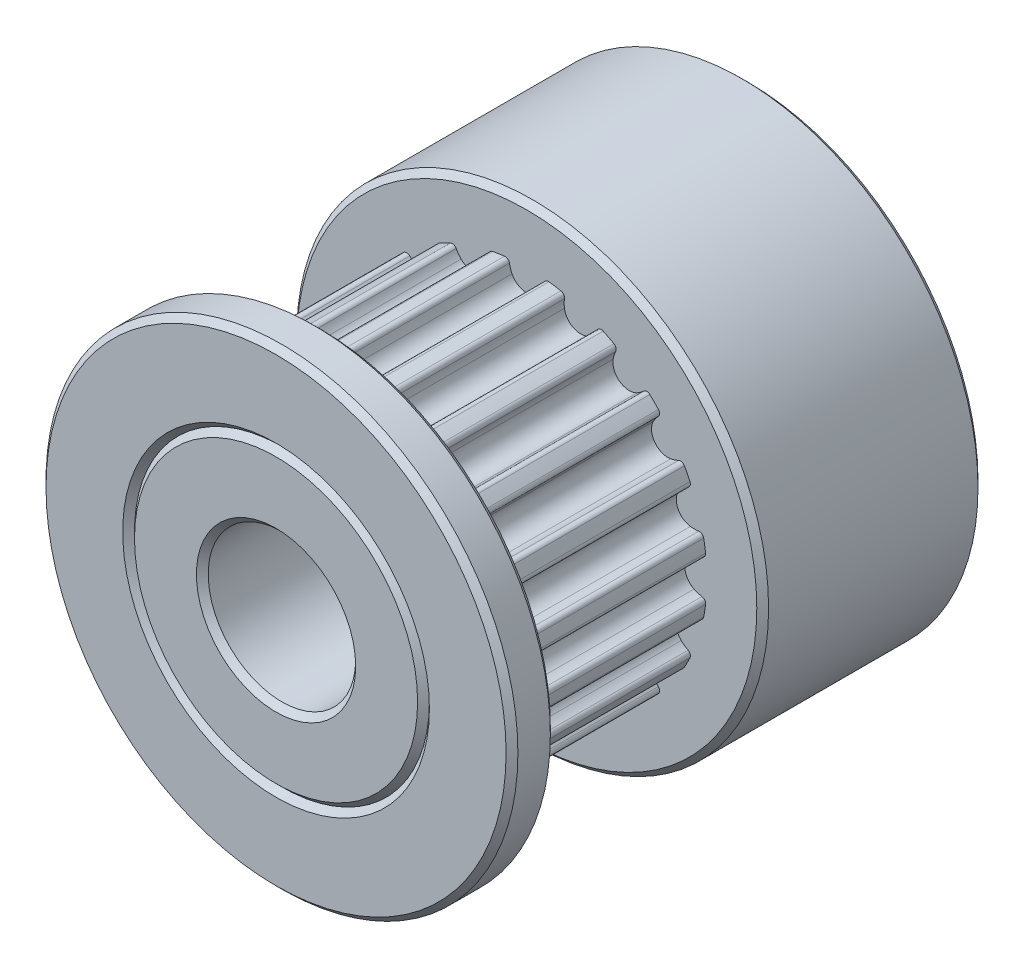
from build123d import *

# Parameters (mm, degrees)
CHAMFER_1_SIZE      = 0.2
CUT_EXTRUDE_START   = -1.5
CUT_EXTRUDE_4_DEPTH = 7
FILLET_1_R          = 0.15


with BuildPart() as part:
    # Эскиз2 → Повернуть1 (revolve)
    with BuildSketch(Plane(origin=(0, 0, 0), x_dir=(0, 0, -1), z_dir=(1, 0, 0)), mode=Mode.PRIVATE) as revolve_1_sk:
        Polygon((0, 4.8), (0, 2.5), (16, 2.5), (16, 4.8), (15.8, 5), (16, 5.2), (16, 8), (8.5, 8), (8.5, 6.11), (1.5, 6.11), (1.5, 8), (0, 8), (0, 5.2), (0.2, 5), align=None)
    revolve(revolve_1_sk.sketch.rotate(Axis((0, 0, 14.55226209), (0, 0, -1)), 90), axis=Axis((0, 0, 14.55226209), (0, 0, -1)))

    # Фаска1
    chamfer_1_edges = [part.edges().sort_by_distance(p)[0] for p in [
        (-8, 0, 0),
        (-8, 0, -1.5),
        (-8, 0, -8.5),
        (-8, 0, -16),
        (-2.5, 0, -16),
        (-2.5, 0, 0),
    ]]
    chamfer(chamfer_1_edges, length=CHAMFER_1_SIZE)

    # Эскиз3 → Вырез-Вытянуть4 (cut)
    with BuildSketch(Plane.XY.offset(CUT_EXTRUDE_START)):
        with BuildLine():
            ThreePointArc((-0.498876404, 5.671797753), (0, 5.36), (0.498876404, 5.671797753))
            ThreePointArc((0.498876404, 5.671797753), (0.570969524, 5.870796774), (0.599565123, 6.080511628))
            ThreePointArc((0.599565123, 6.080511628), (0, 6.11), (-0.599565123, 6.080511628))
            ThreePointArc((-0.599565123, 6.080511628), (-0.570969524, 5.870796774), (-0.498876404, 5.671797753))
        make_face()
        with BuildLine():
            ThreePointArc((2.22714155, 5.240038925), (2.35720026, 5.407020242), (2.449201745, 5.597634394))
            ThreePointArc((2.449201745, 5.597634394), (1.888093836, 5.810955315), (1.30876111, 5.968186019))
            ThreePointArc((1.30876111, 5.968186019), (1.271151687, 5.759898814), (1.278222239, 5.548361499))
            ThreePointArc((1.278222239, 5.548361499), (1.65633109, 5.097662927), (2.22714155, 5.240038925))
        make_face()
        with BuildLine():
            ThreePointArc((3.737398562, 4.295348577), (3.912691811, 4.413966895), (4.059093436, 4.566821705))
            ThreePointArc((4.059093436, 4.566821705), (3.591367892, 4.943093836), (3.088976687, 5.271652779))
            ThreePointArc((3.088976687, 5.271652779), (2.988843715, 5.085181827), (2.930199584, 4.881812964))
            ThreePointArc((2.930199584, 4.881812964), (3.150528952, 4.33633109), (3.737398562, 4.295348577))
        make_face()
        with BuildLine():
            ThreePointArc((4.881812964, 2.930199584), (5.085181827, 2.988843715), (5.271652779, 3.088976687))
            ThreePointArc((5.271652779, 3.088976687), (4.943093836, 3.591367892), (4.566821705, 4.059093436))
            ThreePointArc((4.566821705, 4.059093436), (4.413966895, 3.912691811), (4.295348577, 3.737398562))
            ThreePointArc((4.295348577, 3.737398562), (4.33633109, 3.150528952), (4.881812964, 2.930199584))
        make_face()
        with BuildLine():
            ThreePointArc((5.548361499, 1.278222239), (5.759898814, 1.271151687), (5.968186019, 1.30876111))
            ThreePointArc((5.968186019, 1.30876111), (5.810955315, 1.888093836), (5.597634394, 2.449201745))
            ThreePointArc((5.597634394, 2.449201745), (5.407020242, 2.35720026), (5.240038925, 2.22714155))
            ThreePointArc((5.240038925, 2.22714155), (5.097662927, 1.65633109), (5.548361499, 1.278222239))
        make_face()
        with BuildLine():
            ThreePointArc((5.671797753, -0.498876404), (5.870796774, -0.570969524), (6.080511628, -0.599565123))
            ThreePointArc((6.080511628, -0.599565123), (6.11, 0), (6.080511628, 0.599565123))
            ThreePointArc((6.080511628, 0.599565123), (5.870796774, 0.570969524), (5.671797753, 0.498876404))
            ThreePointArc((5.671797753, 0.498876404), (5.36, 0), (5.671797753, -0.498876404))
        make_face()
        with BuildLine():
            ThreePointArc((5.240038925, -2.22714155), (5.407020242, -2.35720026), (5.597634394, -2.449201745))
            ThreePointArc((5.597634394, -2.449201745), (5.810955315, -1.888093836), (5.968186019, -1.30876111))
            ThreePointArc((5.968186019, -1.30876111), (5.759898814, -1.271151687), (5.548361499, -1.278222239))
            ThreePointArc((5.548361499, -1.278222239), (5.097662927, -1.65633109), (5.240038925, -2.22714155))
        make_face()
        with BuildLine():
            ThreePointArc((4.295348577, -3.737398562), (4.413966895, -3.912691811), (4.566821705, -4.059093436))
            ThreePointArc((4.566821705, -4.059093436), (4.943093836, -3.591367892), (5.271652779, -3.088976687))
            ThreePointArc((5.271652779, -3.088976687), (5.085181827, -2.988843715), (4.881812964, -2.930199584))
            ThreePointArc((4.881812964, -2.930199584), (4.33633109, -3.150528952), (4.295348577, -3.737398562))
        make_face()
        with BuildLine():
            ThreePointArc((2.930199584, -4.881812964), (2.988843715, -5.085181827), (3.088976687, -5.271652779))
            ThreePointArc((3.088976687, -5.271652779), (3.591367892, -4.943093836), (4.059093436, -4.566821705))
            ThreePointArc((4.059093436, -4.566821705), (3.912691811, -4.413966895), (3.737398562, -4.295348577))
            ThreePointArc((3.737398562, -4.295348577), (3.150528952, -4.33633109), (2.930199584, -4.881812964))
        make_face()
        with BuildLine():
            ThreePointArc((1.278222239, -5.548361499), (1.271151687, -5.759898814), (1.30876111, -5.968186019))
            ThreePointArc((1.30876111, -5.968186019), (1.888093836, -5.810955315), (2.449201745, -5.597634394))
            ThreePointArc((2.449201745, -5.597634394), (2.35720026, -5.407020242), (2.22714155, -5.240038925))
            ThreePointArc((2.22714155, -5.240038925), (1.65633109, -5.097662927), (1.278222239, -5.548361499))
        make_face()
        with BuildLine():
            ThreePointArc((-0.498876404, -5.671797753), (-0.570969524, -5.870796774), (-0.599565123, -6.080511628))
            ThreePointArc((-0.599565123, -6.080511628), (0, -6.11), (0.599565123, -6.080511628))
            ThreePointArc((0.599565123, -6.080511628), (0.570969524, -5.870796774), (0.498876404, -5.671797753))
            ThreePointArc((0.498876404, -5.671797753), (0, -5.36), (-0.498876404, -5.671797753))
        make_face()
        with BuildLine():
            ThreePointArc((-2.22714155, -5.240038925), (-2.35720026, -5.407020242), (-2.449201745, -5.597634394))
            ThreePointArc((-2.449201745, -5.597634394), (-1.888093836, -5.810955315), (-1.30876111, -5.968186019))
            ThreePointArc((-1.30876111, -5.968186019), (-1.271151687, -5.759898814), (-1.278222239, -5.548361499))
            ThreePointArc((-1.278222239, -5.548361499), (-1.65633109, -5.097662927), (-2.22714155, -5.240038925))
        make_face()
        with BuildLine():
            ThreePointArc((-3.737398562, -4.295348577), (-3.912691811, -4.413966895), (-4.059093436, -4.566821705))
            ThreePointArc((-4.059093436, -4.566821705), (-3.591367892, -4.943093836), (-3.088976687, -5.271652779))
            ThreePointArc((-3.088976687, -5.271652779), (-2.988843715, -5.085181827), (-2.930199584, -4.881812964))
            ThreePointArc((-2.930199584, -4.881812964), (-3.150528952, -4.33633109), (-3.737398562, -4.295348577))
        make_face()
        with BuildLine():
            ThreePointArc((-4.881812964, -2.930199584), (-5.085181827, -2.988843715), (-5.271652779, -3.088976687))
            ThreePointArc((-5.271652779, -3.088976687), (-4.943093836, -3.591367892), (-4.566821705, -4.059093436))
            ThreePointArc((-4.566821705, -4.059093436), (-4.413966895, -3.912691811), (-4.295348577, -3.737398562))
            ThreePointArc((-4.295348577, -3.737398562), (-4.33633109, -3.150528952), (-4.881812964, -2.930199584))
        make_face()
        with BuildLine():
            ThreePointArc((-5.548361499, -1.278222239), (-5.759898814, -1.271151687), (-5.968186019, -1.30876111))
            ThreePointArc((-5.968186019, -1.30876111), (-5.810955315, -1.888093836), (-5.597634394, -2.449201745))
            ThreePointArc((-5.597634394, -2.449201745), (-5.407020242, -2.35720026), (-5.240038925, -2.22714155))
            ThreePointArc((-5.240038925, -2.22714155), (-5.097662927, -1.65633109), (-5.548361499, -1.278222239))
        make_face()
        with BuildLine():
            ThreePointArc((-5.671797753, 0.498876404), (-5.870796774, 0.570969524), (-6.080511628, 0.599565123))
            ThreePointArc((-6.080511628, 0.599565123), (-6.11, 0), (-6.080511628, -0.599565123))
            ThreePointArc((-6.080511628, -0.599565123), (-5.870796774, -0.570969524), (-5.671797753, -0.498876404))
            ThreePointArc((-5.671797753, -0.498876404), (-5.36, 0), (-5.671797753, 0.498876404))
        make_face()
        with BuildLine():
            ThreePointArc((-5.240038925, 2.22714155), (-5.407020242, 2.35720026), (-5.597634394, 2.449201745))
            ThreePointArc((-5.597634394, 2.449201745), (-5.810955315, 1.888093836), (-5.968186019, 1.30876111))
            ThreePointArc((-5.968186019, 1.30876111), (-5.759898814, 1.271151687), (-5.548361499, 1.278222239))
            ThreePointArc((-5.548361499, 1.278222239), (-5.097662927, 1.65633109), (-5.240038925, 2.22714155))
        make_face()
        with BuildLine():
            ThreePointArc((-4.295348577, 3.737398562), (-4.413966895, 3.912691811), (-4.566821705, 4.059093436))
            ThreePointArc((-4.566821705, 4.059093436), (-4.943093836, 3.591367892), (-5.271652779, 3.088976687))
            ThreePointArc((-5.271652779, 3.088976687), (-5.085181827, 2.988843715), (-4.881812964, 2.930199584))
            ThreePointArc((-4.881812964, 2.930199584), (-4.33633109, 3.150528952), (-4.295348577, 3.737398562))
        make_face()
        with BuildLine():
            ThreePointArc((-2.930199584, 4.881812964), (-2.988843715, 5.085181827), (-3.088976687, 5.271652779))
            ThreePointArc((-3.088976687, 5.271652779), (-3.591367892, 4.943093836), (-4.059093436, 4.566821705))
            ThreePointArc((-4.059093436, 4.566821705), (-3.912691811, 4.413966895), (-3.737398562, 4.295348577))
            ThreePointArc((-3.737398562, 4.295348577), (-3.150528952, 4.33633109), (-2.930199584, 4.881812964))
        make_face()
        with BuildLine():
            ThreePointArc((-1.278222239, 5.548361499), (-1.271151687, 5.759898814), (-1.30876111, 5.968186019))
            ThreePointArc((-1.30876111, 5.968186019), (-1.888093836, 5.810955315), (-2.449201745, 5.597634394))
            ThreePointArc((-2.449201745, 5.597634394), (-2.35720026, 5.407020242), (-2.22714155, 5.240038925))
            ThreePointArc((-2.22714155, 5.240038925), (-1.65633109, 5.097662927), (-1.278222239, 5.548361499))
        make_face()
    extrude(amount=-CUT_EXTRUDE_4_DEPTH, mode=Mode.SUBTRACT)

    # Скругление1
    fillet_1_edges = [part.edges().sort_by_distance(p)[0] for p in [
        (6.080511628, 0.599565123, -5),
        (6.080511628, -0.599565123, -5),
        (5.968186019, -1.30876111, -5),
        (5.597634394, -2.449201745, -5),
        (5.271652779, -3.088976687, -5),
        (4.566821705, -4.059093436, -5),
        (4.059093436, -4.566821705, -5),
        (3.088976687, -5.271652779, -5),
        (2.449201745, -5.597634394, -5),
        (1.30876111, -5.968186019, -5),
        (0.599565123, -6.080511628, -5),
        (-0.599565123, -6.080511628, -5),
        (-1.30876111, -5.968186019, -5),
        (-2.449201745, -5.597634394, -5),
        (-3.088976687, -5.271652779, -5),
        (-4.059093436, -4.566821705, -5),
        (-4.566821705, -4.059093436, -5),
        (-5.271652779, -3.088976687, -5),
        (-5.597634394, -2.449201745, -5),
        (-5.968186019, -1.30876111, -5),
        (-6.080511628, -0.599565123, -5),
        (-6.080511628, 0.599565123, -5),
        (-5.968186019, 1.30876111, -5),
        (-5.597634394, 2.449201745, -5),
        (-5.271652779, 3.088976687, -5),
        (-4.566821705, 4.059093436, -5),
        (-4.059093436, 4.566821705, -5),
        (-3.088976687, 5.271652779, -5),
        (-2.449201745, 5.597634394, -5),
        (-1.30876111, 5.968186019, -5),
        (-0.599565123, 6.080511628, -5),
        (0.599565123, 6.080511628, -5),
        (1.30876111, 5.968186019, -5),
        (2.449201745, 5.597634394, -5),
        (3.088976687, 5.271652779, -5),
        (4.059093436, 4.566821705, -5),
        (4.566821705, 4.059093436, -5),
        (5.271652779, 3.088976687, -5),
        (5.597634394, 2.449201745, -5),
        (5.968186019, 1.30876111, -5),
    ]]
    fillet(fillet_1_edges, radius=FILLET_1_R)


solid = part.part
